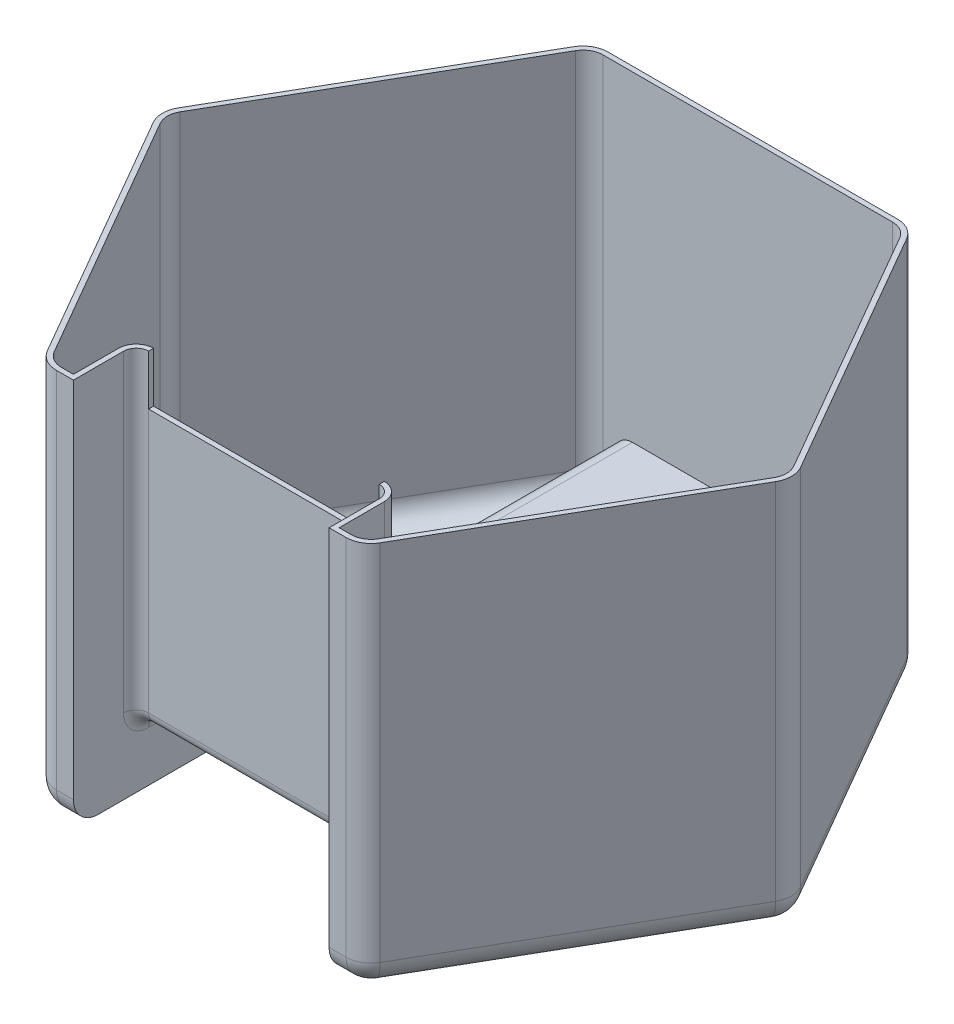
from build123d import *

# Parameters (mm, degrees)
BOSS_EXTRUDE1_DEPTH = 155
CUT_EXTRUDE1_REACH  = 230.601
SKETCH2_W           = 102
SKETCH2_H           = 25
CUT_EXTRUDE2_REACH  = 281.613
SKETCH3_W           = 102
SKETCH3_H           = 25
FILLET1_R           = 5
FILLET2_R           = 10
FILLET4_R           = 10
SHELL1_T            = -2
CUT_EXTRUDE3_REACH  = 280.913
SKETCH9_W           = 92
SKETCH9_H           = 20


with BuildPart() as part:
    # Sketch1 → Boss-Extrude1 (new body)
    with BuildSketch(Plane(origin=(0, 0, 0), x_dir=(1, 0, 0), z_dir=(0, 1, 0))):
        Polygon((63.508529611, 110), (-63.508529611, 110), (-127.017059222, 0), (-63.508529611, -110), (63.508529611, -110), (127.017059222, 0), align=None)
    extrude(amount=BOSS_EXTRUDE1_DEPTH)

    # Sketch2 → Cut-Extrude1 (cut, up to next)
    with BuildSketch(Plane(origin=(0, 155, 0), x_dir=(1, 0, 0), z_dir=(0, 1, 0)), mode=Mode.PRIVATE) as cut_extrude1_sk1:
        with Locations((0, -97.5)):
            Rectangle(SKETCH2_W, SKETCH2_H)
    cut_extrude1_tool1 = extrude(cut_extrude1_sk1.sketch, amount=-CUT_EXTRUDE1_REACH, mode=Mode.PRIVATE) & part.part
    add(cut_extrude1_tool1.solids().sort_by_distance((0, 155, 97.5))[0], mode=Mode.SUBTRACT)

    # Sketch3 → Cut-Extrude2 (cut, up to next)
    with BuildSketch(Plane.XY.offset(85), mode=Mode.PRIVATE) as cut_extrude2_sk1:
        with Locations((0, 12.5)):
            Rectangle(SKETCH3_W, SKETCH3_H)
    cut_extrude2_tool1 = extrude(cut_extrude2_sk1.sketch, amount=-CUT_EXTRUDE2_REACH, mode=Mode.PRIVATE) & part.part
    add(cut_extrude2_tool1.solids().sort_by_distance((0, 12.5, 85))[0], mode=Mode.SUBTRACT)

    # Fillet1
    fillet1_edges = [part.edges().sort_by_distance(p)[0] for p in [
        (51, 90, 85),
        (-51, 90, 85),
        (-51, 25, -12.5),
        (51, 25, -12.5),
        (0, 25, 85),
    ]]
    fillet(fillet1_edges, radius=FILLET1_R)

    # Fillet2
    fillet2_edges = [part.edges().sort_by_distance(p)[0] for p in [
        (127.017059222, 77.5, 0),
        (63.508529611, 77.5, 110),
        (-63.508529611, 77.5, 110),
        (-127.017059222, 77.5, 0),
        (-63.508529611, 77.5, -110),
        (63.508529611, 77.5, -110),
    ]]
    fillet(fillet2_edges, radius=FILLET2_R)

    # Fillet4
    fillet4_edges = [part.edges().sort_by_distance(p)[0] for p in [
        (54.367513459, 0, 110),
        (-54.367513459, 0, -110),
        (95.262794416, 0, 55),
        (54.367513459, 0, -110),
        (95.262794416, 0, -55),
        (62.735026919, 0, -108.660254038),
        (125.470053838, 0, 0),
        (62.735026919, 0, 108.660254038),
        (-95.262794416, 0, -55),
        (-54.367513459, 0, 110),
        (-95.262794416, 0, 55),
        (-62.735026919, 0, 108.660254038),
        (-125.470053838, 0, 0),
        (-62.735026919, 0, -108.660254038),
    ]]
    fillet(fillet4_edges, radius=FILLET4_R)

    # Shell1
    shell1_openings = [part.faces().sort_by_distance(p)[0] for p in [
        (0, 155, -6.295757264),
    ]]
    offset(amount=SHELL1_T, openings=shell1_openings, kind=Kind.INTERSECTION)

    # Sketch9 → Cut-Extrude3 (cut, up to next)
    with BuildSketch(Plane.XY.offset(85), mode=Mode.PRIVATE) as cut_extrude3_sk1:
        with Locations((0, 145)):
            Rectangle(SKETCH9_W, SKETCH9_H)
    cut_extrude3_tool1 = extrude(cut_extrude3_sk1.sketch, amount=-CUT_EXTRUDE3_REACH, mode=Mode.PRIVATE) & part.part
    add(cut_extrude3_tool1.solids().sort_by_distance((0, 145, 85))[0], mode=Mode.SUBTRACT)


solid = part.part
